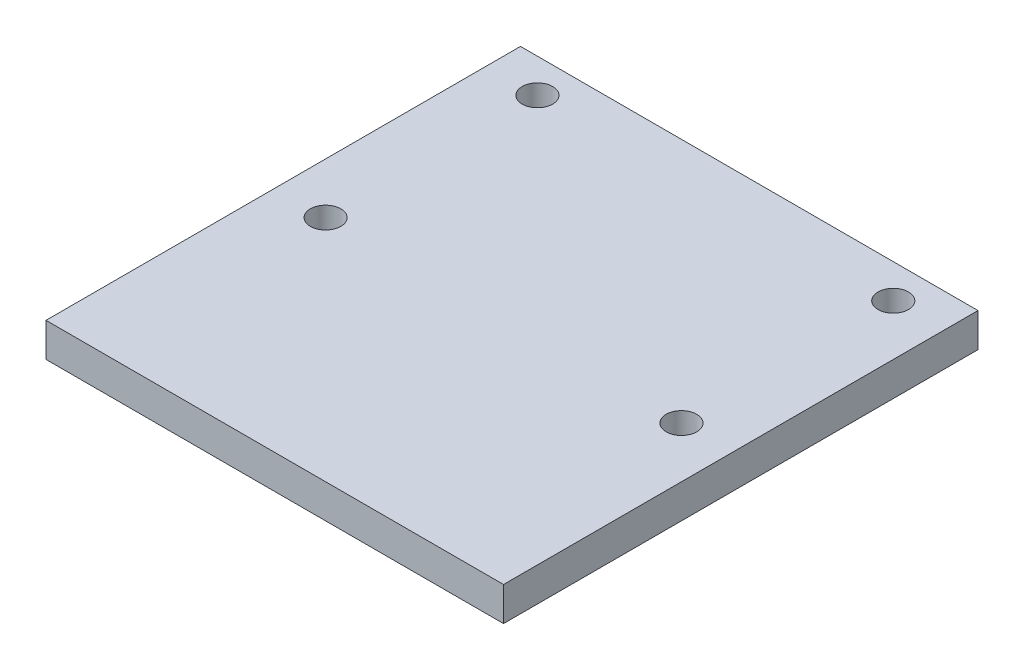
from build123d import *

# Parameters (mm, degrees)
SKETCH3_W           = 27
SKETCH3_H           = 28
BOSS_EXTRUDE1_DEPTH = 2
SKETCH2_R           = 0.9
CUT_EXTRUDE1_DEPTH  = 10


with BuildPart() as part:
    # Sketch3 → Boss-Extrude1 (new body)
    with BuildSketch(Plane(origin=(0, 0, 0), x_dir=(1, 0, 0), z_dir=(0, 1, 0))):
        with Locations((0, -14)):
            Rectangle(SKETCH3_W, SKETCH3_H)
    extrude(amount=-BOSS_EXTRUDE1_DEPTH)

    # Sketch2 → Cut-Extrude1 (cut)
    with BuildSketch(Plane(origin=(0, 0, 0), x_dir=(1, 0, 0), z_dir=(0, 1, 0))):
        with Locations(Location((-10.5, -2, 0), (0, 0, 270))):
            Circle(SKETCH2_R)
        with Locations(Location((-10.5, -14.5, 0), (0, 0, 270))):
            Circle(SKETCH2_R)
        with Locations(Location((10.5, -14.5, 0), (0, 0, 270))):
            Circle(SKETCH2_R)
        with Locations(Location((10.5, -2, 0), (0, 0, 270))):
            Circle(SKETCH2_R)
    extrude(amount=-CUT_EXTRUDE1_DEPTH, mode=Mode.SUBTRACT)


solid = part.part
